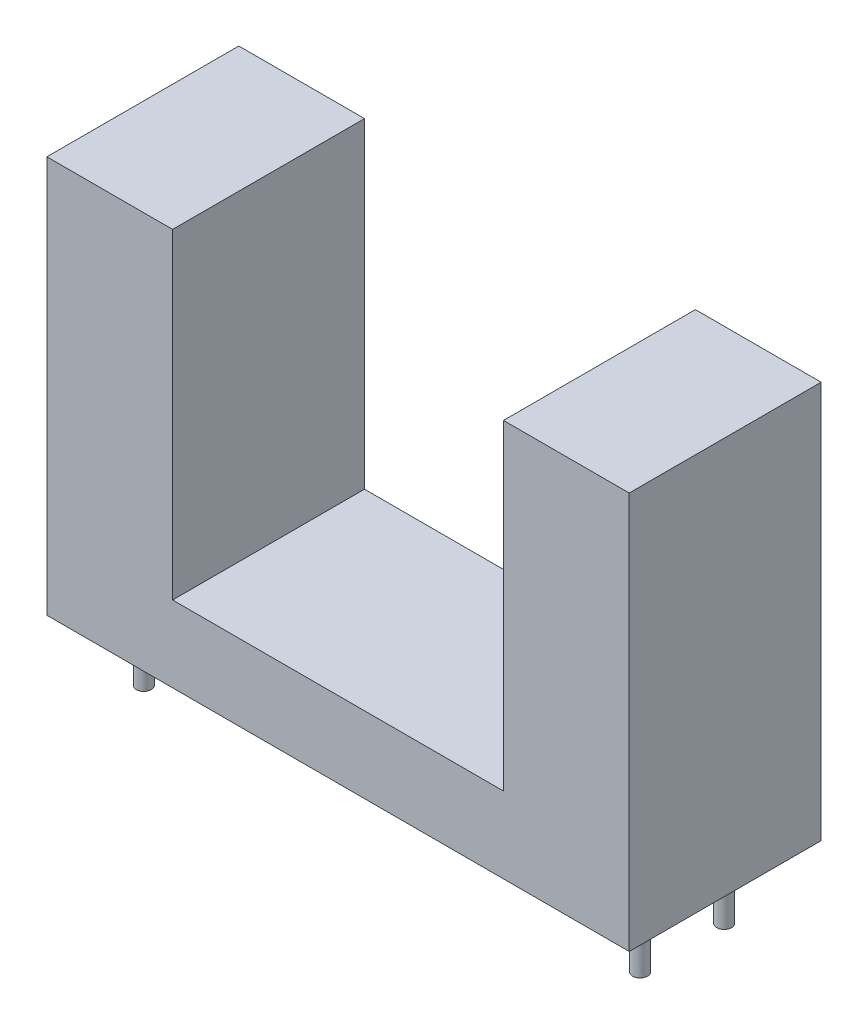
from build123d import *

# Parameters (mm, degrees)
SKETCH_1_W      = 17.6
SKETCH_1_H      = 5.8
EXTRUDE_1_DEPTH = 2.3
SKETCH_2_W      = 3.8
SKETCH_2_H      = 5.8
EXTRUDE_2_DEPTH = 9.7
SKETCH_5_R      = 0.225
EXTRUDE_3_DEPTH = 2


with BuildPart() as part:
    # 草图1 → 凸台-拉伸1 (new body)
    with BuildSketch(Plane(origin=(0, 0, 0), x_dir=(1, 0, 0), z_dir=(0, 1, 0))):
        Rectangle(SKETCH_1_W, SKETCH_1_H)
    extrude(amount=EXTRUDE_1_DEPTH)

    # 草图2 → 凸台-拉伸2 (add)
    with BuildSketch(Plane(origin=(0, 2.3, 0), x_dir=(1, 0, 0), z_dir=(0, 1, 0))):
        with Locations((-6.9, 0)):
            Rectangle(SKETCH_2_W, SKETCH_2_H)
        with Locations((6.9, 0)):
            Rectangle(SKETCH_2_W, SKETCH_2_H)
    extrude(amount=EXTRUDE_2_DEPTH)

    # 草图5 → 凸台-拉伸3 (add)
    with BuildSketch(Plane.XZ):
        with Locations(Location((-7.5, 1.27, 0), (0, 0, 90))):
            Circle(SKETCH_5_R)
        with Locations(Location((-7.5, -1.27, 0), (0, 0, 90))):
            Circle(SKETCH_5_R)
        with Locations(Location((7.5, 1.27, 0), (0, 0, 90))):
            Circle(SKETCH_5_R)
        with Locations(Location((7.5, -1.27, 0), (0, 0, 90))):
            Circle(SKETCH_5_R)
    extrude(amount=EXTRUDE_3_DEPTH)


solid = part.part
